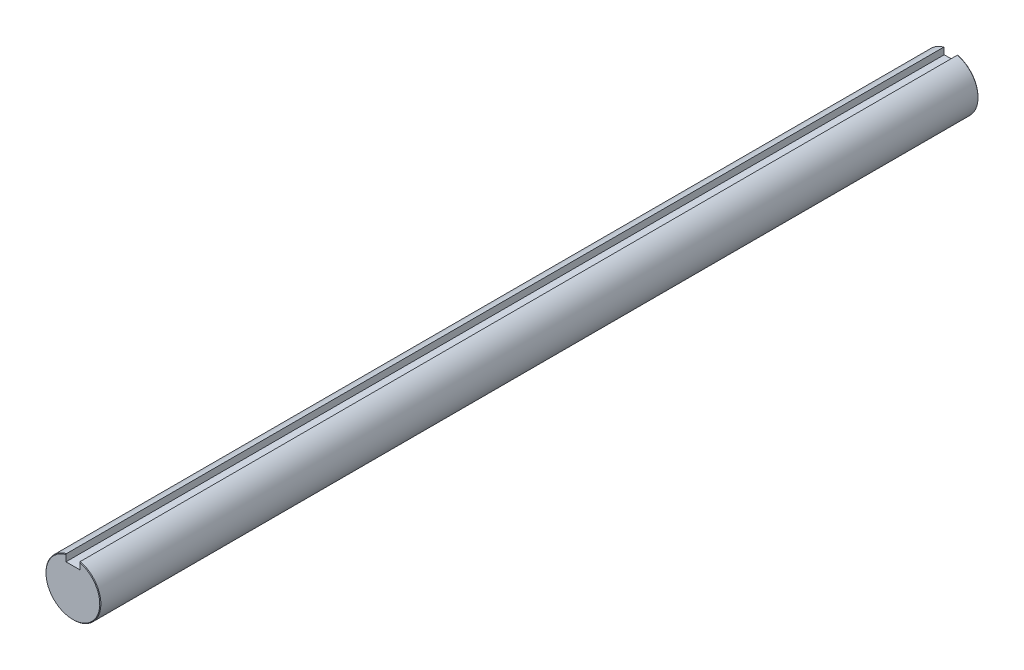
from build123d import *

# Parameters (mm, degrees)
BOSS_EXTRUDE1_DEPTH      = 76.2
BOSS_EXTRUDE1_DEPTH_BACK = 76.2
CHAMFER1_SIZE            = 0.09525


with BuildPart() as part:
    # Sketch3 → Boss-Extrude1 (new, two sides: drawn at the far end of the back side and taken through both)
    with BuildSketch(Plane.XY.offset(-BOSS_EXTRUDE1_DEPTH_BACK)):
        with BuildLine():
            Line((-1.1938, 3.416649849), (-1.1938, 4.610449849))
            ThreePointArc((-1.1938, 4.610449849), (0, -4.7625), (1.1938, 4.610449849))
            Line((1.1938, 4.610449849), (1.1938, 3.416649849))
            Line((1.1938, 3.416649849), (-1.1938, 3.416649849))
        make_face()
    extrude(amount=BOSS_EXTRUDE1_DEPTH + BOSS_EXTRUDE1_DEPTH_BACK)

    # Chamfer1
    chamfer1_edges = [part.edges().sort_by_distance(p)[0] for p in [
        (0, -4.7625, -76.2),
        (0, -4.7625, 76.2),
    ]]
    chamfer(chamfer1_edges, length=CHAMFER1_SIZE)


solid = part.part
